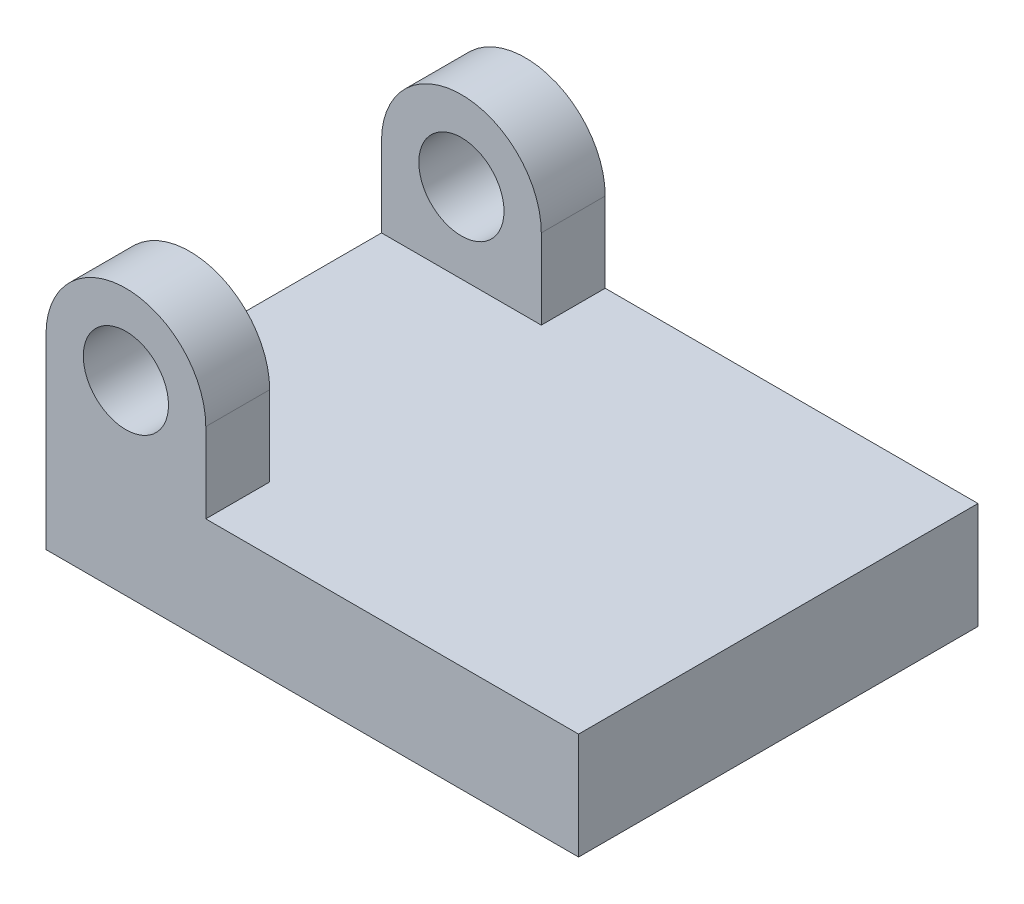
from build123d import *

# Parameters (mm, degrees)
SKETCH_1_W          = 20
SKETCH_1_H          = 15
EXTRUDE_2_DEPTH     = 4
SKETCH_3_W          = 6
SKETCH_3_H          = 15
EXTRUDE_3_DEPTH     = 6
SKETCH_4_W          = 6
SKETCH_4_H          = 10.2
CUT_EXTRUDE_1_DEPTH = 6
SKETCH_5_R          = 1.6
CUT_EXTRUDE_2_DEPTH = 21


with BuildPart() as part:
    # 草图1 → 凸台-拉伸2 (new body)
    with BuildSketch(Plane(origin=(0, 0, 0), x_dir=(1, 0, 0), z_dir=(0, 1, 0))):
        with Locations((-2.334337349, -1.016566265)):
            Rectangle(SKETCH_1_W, SKETCH_1_H)
    extrude(amount=EXTRUDE_2_DEPTH)

    # 草图3 → 凸台-拉伸3 (add)
    with BuildSketch(Plane(origin=(0, 4, 0), x_dir=(1, 0, 0), z_dir=(0, 1, 0))):
        with Locations((-9.334337349, -1.016566265)):
            Rectangle(SKETCH_3_W, SKETCH_3_H)
    extrude(amount=EXTRUDE_3_DEPTH)

    # 草图4 → 切除-拉伸1 (cut)
    with BuildSketch(Plane(origin=(0, 10, 0), x_dir=(1, 0, 0), z_dir=(0, 1, 0))):
        with Locations((-9.334337349, -1.016566265)):
            Rectangle(SKETCH_4_W, SKETCH_4_H)
    extrude(amount=-CUT_EXTRUDE_1_DEPTH, mode=Mode.SUBTRACT)

    # 草图5 → 切除-拉伸2 (cut)
    with BuildSketch(Plane.XY.offset(8.516566265)):
        with Locations((-9.334337349, 7)):
            Circle(SKETCH_5_R)
        with BuildLine():
            Line((-9.334337349, 10), (-12.334337349, 10))
            Line((-12.334337349, 10), (-12.334337349, 7))
            ThreePointArc((-12.334337349, 7), (-11.455657693, 9.121320344), (-9.334337349, 10))
        make_face()
        with BuildLine():
            Line((-6.334337349, 10), (-9.334337349, 10))
            ThreePointArc((-9.334337349, 10), (-7.213017006, 9.121320344), (-6.334337349, 7))
            Line((-6.334337349, 7), (-6.334337349, 10))
        make_face()
    extrude(amount=-CUT_EXTRUDE_2_DEPTH, mode=Mode.SUBTRACT)


solid = part.part
